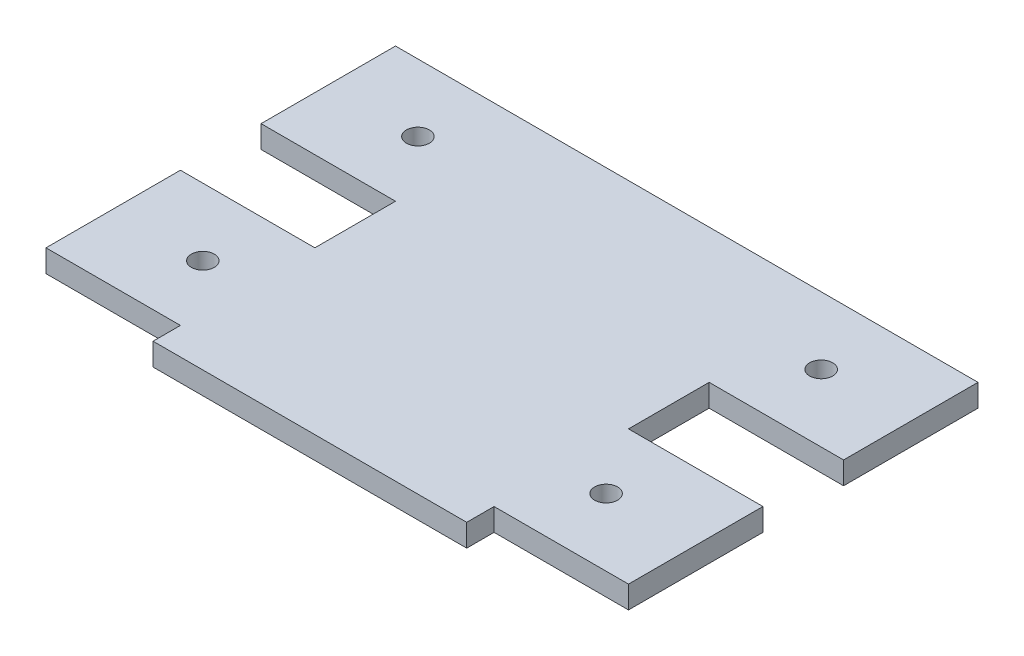
from build123d import *

# Parameters (mm, degrees)
BOSS_EXTRUDE1_DEPTH   = 3.175
F_4_CLEARANCE_HOLE1_D = 3.2639
SKETCH6_W             = 47.36250333
SKETCH6_H             = 20.126599321
CUT_EXTRUDE2_DEPTH    = 95.829208522
SKETCH8_W             = 57.220052793
SKETCH8_H             = 21.750209978
CUT_EXTRUDE4_DEPTH    = 88.381999067


with BuildPart() as part:
    # Sketch2 → Boss-Extrude1 (new body)
    with BuildSketch(Plane(origin=(0, 0, 0), x_dir=(1, 0, 0), z_dir=(0, 1, 0))):
        Polygon((0, 40.894), (-19.05, 40.894), (-19.05, 59.944), (0, 59.944), (0, 70.358), (44.45, 70.358), (44.45, 59.944), (63.5, 59.944), (63.5, 40.894), (44.45, 40.894), (44.45, 29.464), (63.5, 29.464), (63.5, 10.414), (44.45, 10.414), (44.45, 0), (0, 0), (0, 10.414), (-19.05, 10.414), (-19.05, 29.464), (0, 29.464), align=None)
    extrude(amount=BOSS_EXTRUDE1_DEPTH)

    # #4 Clearance Hole1 (through all)
    with Locations(Plane(origin=(0, 3.175, 0), x_dir=(1, 0, 0), z_dir=(0, 1, 0))):
        with Locations((-6.35, 50.419), (50.8, 50.419), (50.8, 19.939), (-6.35, 19.939)):
            Hole(F_4_CLEARANCE_HOLE1_D / 2)

    # Sketch6 → Cut-Extrude2 (cut, through all)
    with BuildSketch(Plane.XZ):
        with Locations((20.768748335, -70.00729966)):
            Rectangle(SKETCH6_W, SKETCH6_H)
    extrude(amount=-CUT_EXTRUDE2_DEPTH, mode=Mode.SUBTRACT)

    # Sketch8 → Cut-Extrude4 (cut, through all)
    with BuildSketch(Plane.XZ):
        with Locations((24.07463768, 4.33828372)):
            Rectangle(SKETCH8_W, SKETCH8_H)
    extrude(amount=-CUT_EXTRUDE4_DEPTH, mode=Mode.SUBTRACT)


solid = part.part
